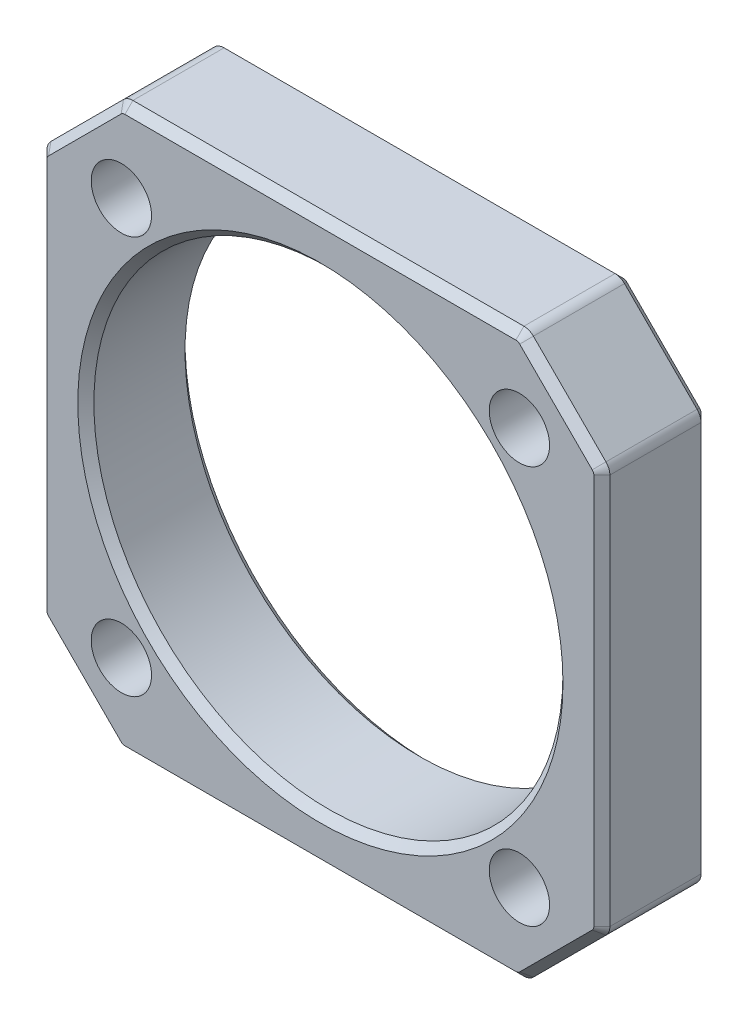
from build123d import *

# Parameters (mm, degrees)
SKETCH1_W            = 42
SKETCH1_H            = 42
SKETCH1_R            = 17.5
BOSS_EXTRUDE1_DEPTH  = 8
M4_CLEARANCE_HOLE1_D = 4.5
CIRPATTERN1_COUNT    = 4
CHAMFER2_SIZE        = 6
FILLET1_R            = 1
CHAMFER1_SIZE        = 0.6


with BuildPart() as part:
    # Sketch1 → Boss-Extrude1 (new body)
    with BuildSketch(Plane.XY):
        Rectangle(SKETCH1_W, SKETCH1_H)
        Circle(SKETCH1_R, mode=Mode.SUBTRACT)
    extrude(amount=BOSS_EXTRUDE1_DEPTH)

    # M4 Clearance Hole1 (through all)
    with Locations(Plane.XY.offset(8)):
        with Locations((14.849242405, 14.849242405)):
            m4_clearance_hole1 = Hole(M4_CLEARANCE_HOLE1_D / 2)

    # CirPattern1: M4 Clearance Hole1 ×4 about axis
    cirpattern1_axis = Axis((0, 0, 0), (0, 0, 1))
    for i in range(1, CIRPATTERN1_COUNT):
        add(m4_clearance_hole1.rotate(cirpattern1_axis, i * 360 / CIRPATTERN1_COUNT), mode=Mode.SUBTRACT)

    # Chamfer2
    chamfer2_edges = [part.edges().sort_by_distance(p)[0] for p in [
        (-21, 21, 4),
        (21, 21, 4),
        (21, -21, 4),
        (-21, -21, 4),
    ]]
    chamfer(chamfer2_edges, length=CHAMFER2_SIZE)

    # Fillet1
    fillet1_edges = [part.edges().sort_by_distance(p)[0] for p in [
        (-21, -15, 4),
        (-21, 15, 4),
        (15, 21, 4),
        (-15, 21, 4),
        (21, -15, 4),
        (21, 15, 4),
        (15, -21, 4),
        (-15, -21, 4),
    ]]
    fillet(fillet1_edges, radius=FILLET1_R)

    # Chamfer1
    chamfer1_edges = [part.edges().sort_by_distance(p)[0] for p in [
        (-17.5, 0, 0),
        (-17.5, 0, 8),
        (21, 0, 0),
        (21, 0, 8),
        (-21, 0, 0),
        (-18, 18, 0),
        (0, 21, 0),
        (18, 18, 0),
        (18, -18, 0),
        (0, -21, 0),
        (-18, -18, 0),
        (20.923879533, 14.96846987, 0),
        (14.96846987, 20.923879533, 0),
        (-14.96846987, 20.923879533, 0),
        (-20.923879533, 14.96846987, 0),
        (-20.923879533, -14.96846987, 0),
        (-14.96846987, -20.923879533, 0),
        (14.96846987, -20.923879533, 0),
        (20.923879533, -14.96846987, 0),
        (18, -18, 8),
        (0, 21, 8),
        (-18, 18, 8),
        (-21, 0, 8),
        (-18, -18, 8),
        (0, -21, 8),
        (18, 18, 8),
        (20.923879533, 14.96846987, 8),
        (14.96846987, 20.923879533, 8),
        (-14.96846987, 20.923879533, 8),
        (-20.923879533, 14.96846987, 8),
        (-20.923879533, -14.96846987, 8),
        (-14.96846987, -20.923879533, 8),
        (14.96846987, -20.923879533, 8),
        (20.923879533, -14.96846987, 8),
    ]]
    chamfer(chamfer1_edges, length=CHAMFER1_SIZE)


solid = part.part
